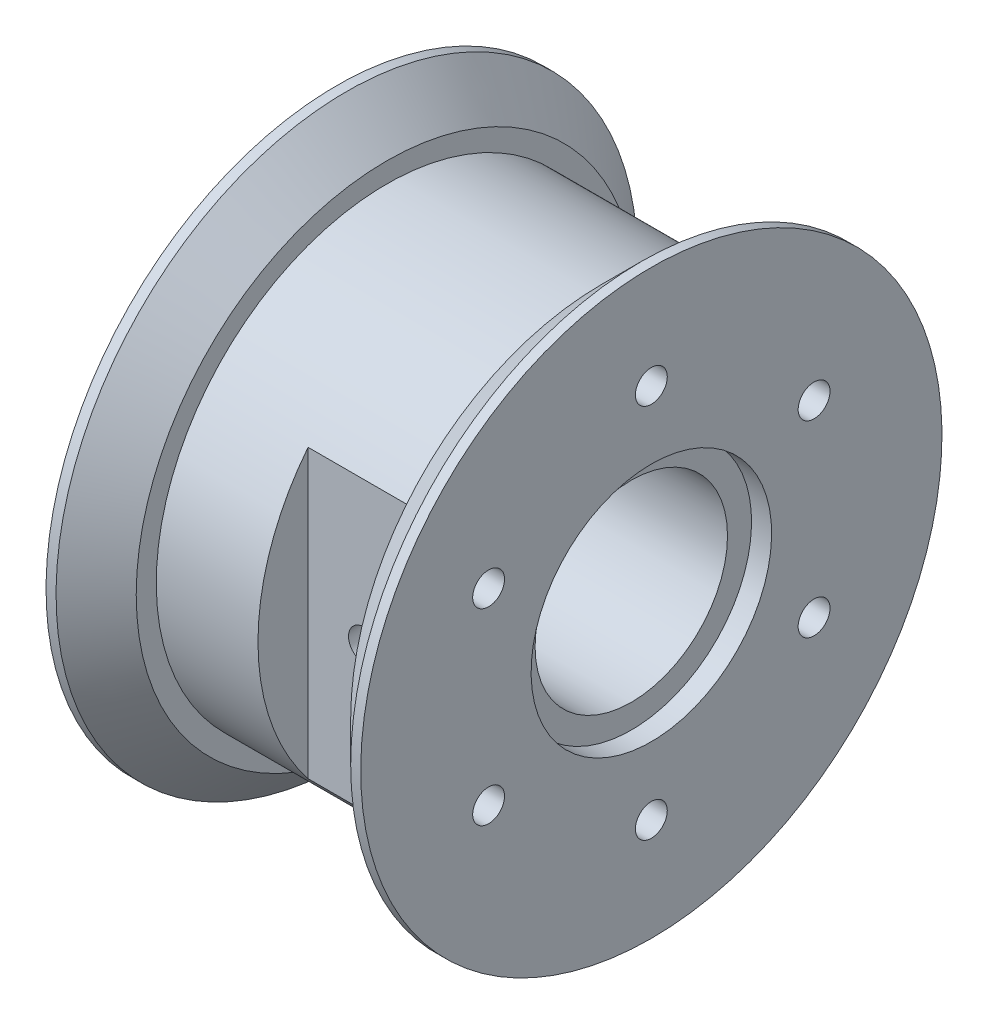
from build123d import *

# Parameters (mm, degrees)
SKETCH4_R                  = 15.24
CUT_EXTRUDE1_DEPTH         = 2.54
CIRPATTERN1_COUNT          = 6
CUT_EXTRUDE3_DEPTH         = 56.771511733
CUT_EXTRUDE3_DEPTH_BACK    = 56.771511733
SKETCH9_W                  = 14.2875
SKETCH9_H                  = 6.35
F_10_32_TAPPED_HOLE2_D     = 4.0386
F_10_32_TAPPED_HOLE2_DEPTH = 11.938
F_10_32_TAPPED_HOLE2_TIP   = 1.213317848
CHAMFER1_SIZE              = 5.08


with BuildPart() as part:
    # Sketch3 → Revolve1 (revolve)
    with BuildSketch(Plane.XY, mode=Mode.PRIVATE) as revolve1_sk:
        Polygon((-19.939, 12.192), (19.939, 12.192), (19.939, 36.83), (13.589, 36.83), (13.589, 29.21), (-13.589, 29.21), (-13.589, 36.83), (-19.939, 36.83), align=None)
    revolve(revolve1_sk.sketch.rotate(Axis((-36.327412464, 0, 0), (1, 0, 0)), 180), axis=Axis((-36.327412464, 0, 0), (1, 0, 0)))

    # Sketch4 → Cut-Extrude1 (cut)
    with BuildSketch(Plane(origin=(19.939, 0, 0), x_dir=(0, 0, -1), z_dir=(1, 0, 0))):
        with Locations(Location((0, 0, 0), (0, 0, 90))):
            Circle(SKETCH4_R)
    cut_extrude1 = extrude(amount=-CUT_EXTRUDE1_DEPTH, mode=Mode.SUBTRACT)

    # Mirror1: Cut-Extrude1 across plane
    add(cut_extrude1.mirror(Plane(origin=(0, 0, 0), x_dir=(0, 0, 1), z_dir=(1, 0, 0))), mode=Mode.SUBTRACT)

    # Sketch7 → #10-32 Tapped Hole1 (revolve, cut)
    with BuildSketch(Plane(origin=(19.939, -23.8125, 0), x_dir=(0, 0, -1), z_dir=(0, 1, 0))):
        Polygon((0, 0), (0, 13.151317848), (2.0193, 11.938), (2.0193, 0), align=None)
    f_10_32_tapped_hole1 = revolve(axis=Axis((26.289, -23.8125, 0), (-1, 0, 0)), mode=Mode.SUBTRACT)

    # CirPattern1: #10-32 Tapped Hole1 ×6 about axis
    cirpattern1_axis = Axis((0, 0, 0), (1, 0, 0))
    for i in range(1, CIRPATTERN1_COUNT):
        add(f_10_32_tapped_hole1.rotate(cirpattern1_axis, i * 360 / CIRPATTERN1_COUNT), mode=Mode.SUBTRACT)

    # Mirror2: #10-32 Tapped Hole1 across plane
    add(f_10_32_tapped_hole1.mirror(Plane(origin=(0, 0, 0), x_dir=(0, 0, 1), z_dir=(1, 0, 0))), mode=Mode.SUBTRACT)

    # Mirror2 copy 1 sketch → Mirror2 copy 1 (revolve, cut)
    with BuildSketch(Plane(origin=(-19.939, -11.90625, -20.622229928), x_dir=(0, 0.8660254037844386, -0.5000000000000001), z_dir=(0, 0.5000000000000001, 0.8660254037844386))):
        Polygon((0, 0), (0, -13.151317848), (2.0193, -11.938), (2.0193, 0), align=None)
    revolve(axis=Axis((-26.289, -11.90625, -20.622229928), (-1, 0, 0)), mode=Mode.SUBTRACT)

    # Mirror2 copy 2 sketch → Mirror2 copy 2 (revolve, cut)
    with BuildSketch(Plane(origin=(-19.939, 11.90625, -20.622229928), x_dir=(0, 0.8660254037844387, 0.4999999999999998), z_dir=(0, -0.4999999999999998, 0.8660254037844387))):
        Polygon((0, 0), (0, -13.151317848), (2.0193, -11.938), (2.0193, 0), align=None)
    revolve(axis=Axis((-26.289, 11.90625, -20.622229928), (-1, 0, 0)), mode=Mode.SUBTRACT)

    # Mirror2 copy 3 sketch → Mirror2 copy 3 (revolve, cut)
    with BuildSketch(Plane(origin=(-19.939, 23.8125, 0), x_dir=(0, 0, 1), z_dir=(0, -1, 0))):
        Polygon((0, 0), (0, -13.151317848), (2.0193, -11.938), (2.0193, 0), align=None)
    revolve(axis=Axis((-26.289, 23.8125, 0), (-1, 0, 0)), mode=Mode.SUBTRACT)

    # Mirror2 copy 4 sketch → Mirror2 copy 4 (revolve, cut)
    with BuildSketch(Plane(origin=(-19.939, 11.90625, 20.622229928), x_dir=(0, -0.8660254037844384, 0.5000000000000004), z_dir=(0, -0.5000000000000004, -0.8660254037844384))):
        Polygon((0, 0), (0, -13.151317848), (2.0193, -11.938), (2.0193, 0), align=None)
    revolve(axis=Axis((-26.289, 11.90625, 20.622229928), (-1, 0, 0)), mode=Mode.SUBTRACT)

    # Mirror2 copy 5 sketch → Mirror2 copy 5 (revolve, cut)
    with BuildSketch(Plane(origin=(-19.939, -11.90625, 20.622229928), x_dir=(0, -0.8660254037844386, -0.5000000000000001), z_dir=(0, 0.5000000000000001, -0.8660254037844386))):
        Polygon((0, 0), (0, -13.151317848), (2.0193, -11.938), (2.0193, 0), align=None)
    revolve(axis=Axis((-26.289, -11.90625, 20.622229928), (-1, 0, 0)), mode=Mode.SUBTRACT)

    # Sketch9 → Cut-Extrude3 (cut, two sides: drawn at the far end of the back side and taken through both)
    with BuildSketch(Plane(origin=(0, 0, 0), x_dir=(1, 0, 0), z_dir=(0, 1, 0)).offset(-CUT_EXTRUDE3_DEPTH_BACK)):
        with Locations((6.44525, -26.035)):
            Rectangle(SKETCH9_W, SKETCH9_H)
    extrude(amount=CUT_EXTRUDE3_DEPTH + CUT_EXTRUDE3_DEPTH_BACK, mode=Mode.SUBTRACT)

    # #10-32 Tapped Hole2
    with Locations(Plane.XY.offset(22.86)):
        with Locations((6.44525, 0)):
            Hole(F_10_32_TAPPED_HOLE2_D / 2, depth=F_10_32_TAPPED_HOLE2_DEPTH)
            with Locations((0, 0, -(F_10_32_TAPPED_HOLE2_DEPTH + F_10_32_TAPPED_HOLE2_TIP / 2))):  # 118° drill point
                Cone(0, F_10_32_TAPPED_HOLE2_D / 2, F_10_32_TAPPED_HOLE2_TIP, mode=Mode.SUBTRACT)

    # Chamfer1
    chamfer1_edges = [part.edges().sort_by_distance(p)[0] for p in [
        (-13.589, 36.83, 0),
        (13.589, 36.83, 0),
    ]]
    chamfer(chamfer1_edges, length=CHAMFER1_SIZE)


solid = part.part
